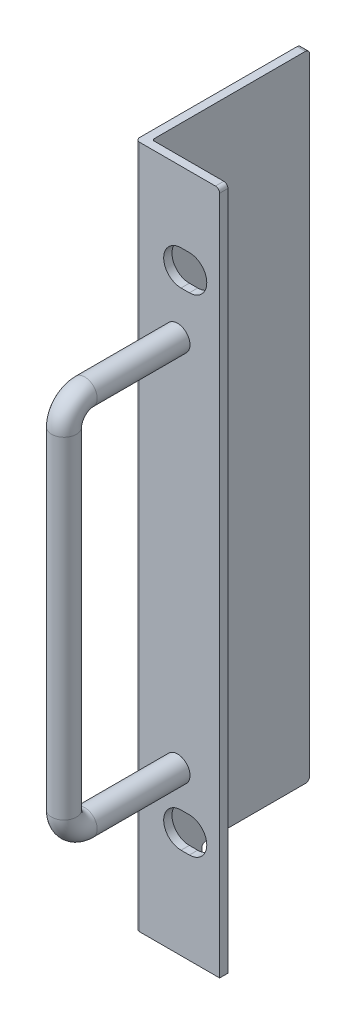
from build123d import *

# Parameters (mm, degrees)
BOSS_EXTRUDE1_DEPTH = 165
CUT_EXTRUDE1_DEPTH  = 132
SKETCH5_R           = 3
SKETCH6_W           = 26
SKETCH6_H           = 12
CUT_EXTRUDE2_DEPTH  = 132
FILLET1_R           = 1
FILLET2_R           = 0.5


with BuildPart() as part:
    # Sketch1 → Boss-Extrude1 (new body)
    with BuildSketch(Plane(origin=(0, 0, 0), x_dir=(1, 0, 0), z_dir=(0, 1, 0))):
        Polygon((0, 0), (0, 40), (2, 40), (2, 2), (20.3, 2), (20.3, 0), align=None)
    extrude(amount=BOSS_EXTRUDE1_DEPTH)

    # Sketch2 → Cut-Extrude1 (cut)
    with BuildSketch(Plane.XY):
        with BuildLine():
            Line((13, 139.545), (11, 139.545))
            ThreePointArc((11, 139.545), (6.8, 143.745), (11, 147.945))
            Line((11, 147.945), (13, 147.945))
            ThreePointArc((13, 147.945), (17.2, 143.745), (13, 139.545))
        make_face()
        with BuildLine():
            Line((13, 30.455), (11, 30.455))
            ThreePointArc((11, 30.455), (6.8, 26.255), (11, 22.055))
            Line((11, 22.055), (13, 22.055))
            ThreePointArc((13, 22.055), (17.2, 26.255), (13, 30.455))
        make_face()
    extrude(amount=-CUT_EXTRUDE1_DEPTH, mode=Mode.SUBTRACT)

    # Sweep1: sweep along a path in Sketch4
    with BuildLine(Plane(origin=(10.15, 0, 0), x_dir=(0, 0, -1), z_dir=(1, 0, 0))) as sweep1_path:
        Line((0, 128.745), (-22.4, 128.745))
        ThreePointArc((-22.4, 128.745), (-25.935533906, 127.280533906), (-27.4, 123.745))
        Line((-27.4, 123.745), (-27.4, 43.745))
        ThreePointArc((-27.4, 43.745), (-25.935533906, 40.209466094), (-22.4, 38.745))
        Line((-22.4, 38.745), (0, 38.745))
    # Sketch5 → Sweep1 (sweep)
    with BuildSketch(Plane.XY):
        with Locations((10.15, 128.745)):
            Circle(SKETCH5_R)
    sweep(path=sweep1_path.line)

    # Sketch6 → Cut-Extrude2 (cut)
    with BuildSketch(Plane(origin=(2, 0, 0), x_dir=(0, 0, -1), z_dir=(1, 0, 0))):
        with Locations((27, 6)):
            Rectangle(SKETCH6_W, SKETCH6_H)
    extrude(amount=-CUT_EXTRUDE2_DEPTH, mode=Mode.SUBTRACT)

    # Fillet1
    fillet1_edges = [part.edges().sort_by_distance(p)[0] for p in [
        (0, 82.5, 0),
        (1, 165, -40),
        (1, 0, -14),
        (20.3, 165, -1),
        (1, 12, -14),
        (1, 12, -40),
    ]]
    fillet(fillet1_edges, radius=FILLET1_R)

    # Fillet2
    fillet2_edges = [part.edges().sort_by_distance(p)[0] for p in [
        (2, 82.5, -2),
    ]]
    fillet(fillet2_edges, radius=FILLET2_R)


solid = part.part
